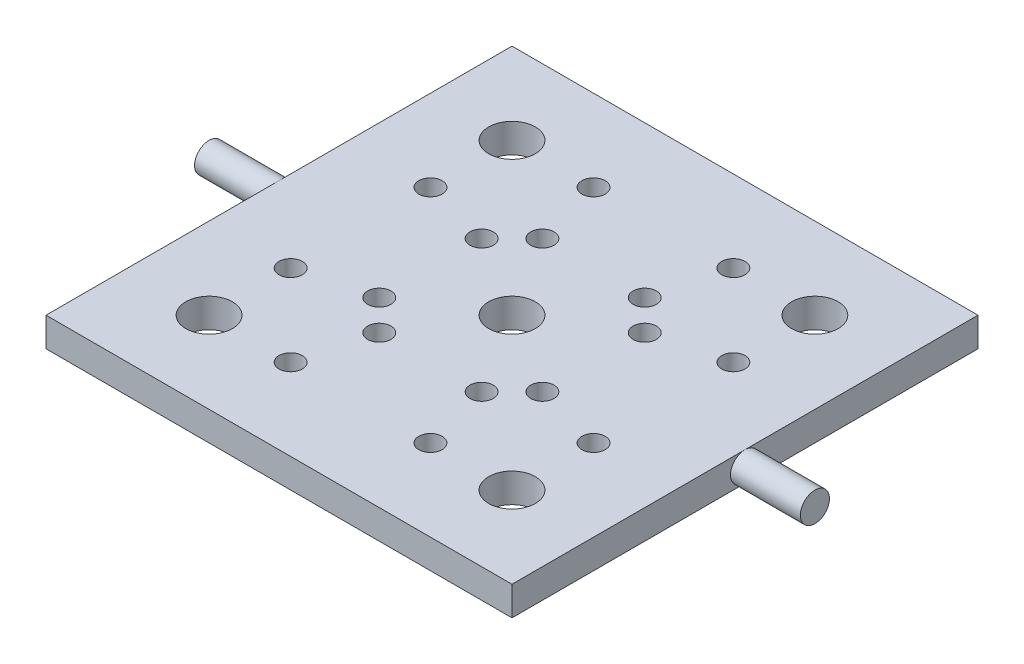
from build123d import *

# Parameters (mm, degrees)
SKETCH1_W           = 50.8
SKETCH1_H           = 50.8
BOSS_EXTRUDE1_DEPTH = 1.5875
SKETCH3_R           = 1.5875
BOSS_EXTRUDE2_DEPTH = 7.62
SKETCH4_R           = 2.54
SKETCH4_R_2         = 1.27
CUT_EXTRUDE1_DEPTH  = 42.77991174


with BuildPart() as part:
    # Sketch1 → Boss-Extrude1 (new, symmetric)
    with BuildSketch(Plane(origin=(0, 0, 0), x_dir=(1, 0, 0), z_dir=(0, 1, 0))):
        Rectangle(SKETCH1_W, SKETCH1_H)
    extrude(amount=BOSS_EXTRUDE1_DEPTH, both=True)

    # Sketch3 → Boss-Extrude2 (add)
    with BuildSketch(Plane(origin=(25.4, 0, 0), x_dir=(0, 0, -1), z_dir=(1, 0, 0))):
        with Locations(Location((0, 0, 0), (0, 0, 270))):
            Circle(SKETCH3_R)
    boss_extrude2 = extrude(amount=BOSS_EXTRUDE2_DEPTH)

    # Mirror1: Boss-Extrude2 across plane
    add(boss_extrude2.mirror(Plane(origin=(0, 0, 0), x_dir=(0, 0, 1), z_dir=(1, 0, 0))))

    # Sketch4 → Cut-Extrude1 (cut, through all)
    with BuildSketch(Plane(origin=(0, 1.5875, 0), x_dir=(1, 0, 0), z_dir=(0, 1, 0))):
        with Locations(Location((0, 0, 0), (0, 0, 270))):
            Circle(SKETCH4_R)
        with Locations(Location((-16.51, 16.51, 0), (0, 0, 270))):
            Circle(SKETCH4_R)
        with Locations(Location((16.51, 16.51, 0), (0, 0, 270))):
            Circle(SKETCH4_R)
        with Locations(Location((16.51, -16.51, 0), (0, 0, 270))):
            Circle(SKETCH4_R)
        with Locations(Location((-16.51, -16.51, 0), (0, 0, 270))):
            Circle(SKETCH4_R)
        with Locations(Location((-16.51, 7.62, 0), (0, 0, 270))):
            Circle(SKETCH4_R_2)
        with Locations(Location((-7.62, 16.51, 0), (0, 0, 270))):
            Circle(SKETCH4_R_2)
        with Locations(Location((7.62, 16.51, 0), (0, 0, 270))):
            Circle(SKETCH4_R_2)
        with Locations(Location((-16.51, -7.62, 0), (0, 0, 270))):
            Circle(SKETCH4_R_2)
        with Locations(Location((7.62, -16.51, 0), (0, 0, 90))):
            Circle(SKETCH4_R_2)
        with Locations(Location((-7.62, -16.51, 0), (0, 0, 90))):
            Circle(SKETCH4_R_2)
        with Locations(Location((16.51, -7.62, 0), (0, 0, 90))):
            Circle(SKETCH4_R_2)
        with Locations(Location((16.51, 7.62, 0), (0, 0, 90))):
            Circle(SKETCH4_R_2)
        with Locations(Location((5.578227154, 8.89, 0), (0, 0, 270))):
            Circle(SKETCH4_R_2)
        with Locations(Location((-5.578227154, 8.89, 0), (0, 0, 270))):
            Circle(SKETCH4_R_2)
        with Locations(Location((8.89, -5.578227154, 0), (0, 0, 270))):
            Circle(SKETCH4_R_2)
        with Locations(Location((8.89, 5.578227154, 0), (0, 0, 270))):
            Circle(SKETCH4_R_2)
        with Locations(Location((-5.578227154, -8.89, 0), (0, 0, 270))):
            Circle(SKETCH4_R_2)
        with Locations(Location((5.578227154, -8.89, 0), (0, 0, 270))):
            Circle(SKETCH4_R_2)
        with Locations(Location((-8.89, 5.578227154, 0), (0, 0, 270))):
            Circle(SKETCH4_R_2)
        with Locations(Location((-8.89, -5.578227154, 0), (0, 0, 270))):
            Circle(SKETCH4_R_2)
    extrude(amount=-CUT_EXTRUDE1_DEPTH, mode=Mode.SUBTRACT)


solid = part.part
